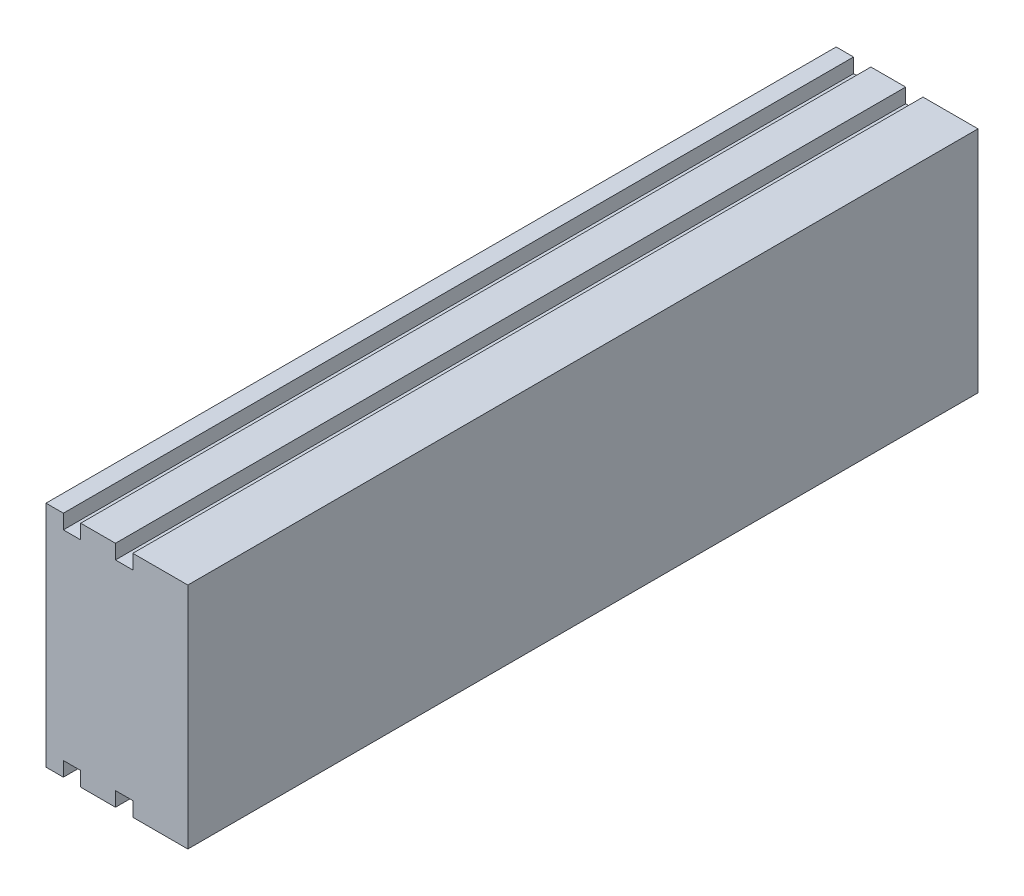
from build123d import *

# Parameters (mm, degrees)
ESQUISSE1_W             = 49
ESQUISSE1_H             = 79
BOSS_EXTRU_1_DEPTH      = 273
ESQUISSE2_W             = 6
ESQUISSE2_H             = 273
ENL_V_MAT_EXTRU_1_DEPTH = 5


with BuildPart() as part:
    # Esquisse1 → Boss.-Extru.1 (new body)
    with BuildSketch(Plane.XY):
        with Locations((24.5, 39.5)):
            Rectangle(ESQUISSE1_W, ESQUISSE1_H)
    extrude(amount=BOSS_EXTRU_1_DEPTH)

    # Esquisse2 → Enlèv. mat.-Extru.1 (cut)
    with BuildSketch(Plane.XZ):
        with Locations((9, 136.5)):
            Rectangle(ESQUISSE2_W, ESQUISSE2_H)
        with Locations((27, 136.5)):
            Rectangle(ESQUISSE2_W, ESQUISSE2_H)
    enl_v_mat_extru_1 = extrude(amount=-ENL_V_MAT_EXTRU_1_DEPTH, mode=Mode.SUBTRACT)

    # Symétrie2: Enlèv. mat.-Extru.1 across plane
    add(enl_v_mat_extru_1.mirror(Plane(origin=(0, 39.5, 0), x_dir=(0, 0, 1), z_dir=(0, -1, 0))), mode=Mode.SUBTRACT)


solid = part.part
